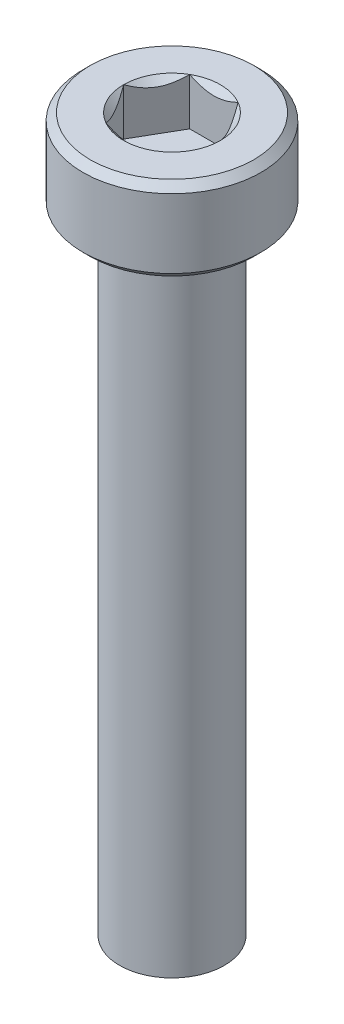
from build123d import *

# Parameters (mm, degrees)
SKETCH1_R           = 4.25
BOSS_EXTRUDE1_DEPTH = 4
CUT_EXTRUDE1_DEPTH  = 2.25
CHAMFER1_SIZE       = 0.35
SKETCH_1_R          = 2.5
EXTRUDE_1_DEPTH     = 30


with BuildPart() as part:
    # Sketch1 → Boss-Extrude1 (new body)
    with BuildSketch(Plane(origin=(0, 0, 0), x_dir=(1, 0, 0), z_dir=(0, 1, 0))):
        with Locations(Location((0, 0, 0), (0, 0, 270))):
            Circle(SKETCH1_R)
    extrude(amount=BOSS_EXTRUDE1_DEPTH)

    # Sketch2 → Cut-Extrude1 (cut)
    with BuildSketch(Plane(origin=(0, 4, 0), x_dir=(1, 0, 0), z_dir=(0, 1, 0))):
        Polygon((1.154700538, 2), (-1.154700538, 2), (-2.309401077, 0), (-1.154700538, -2), (1.154700538, -2), (2.309401077, 0), align=None)
    extrude(amount=-CUT_EXTRUDE1_DEPTH, mode=Mode.SUBTRACT)

    # Cut-Extrude2 cone 1 section (through the dimple's axis) → Cut-Extrude2 (revolve, cut)
    with BuildSketch(Plane(origin=(0, 4, 0), x_dir=(0, 0, 1), z_dir=(1, 0, 0))):
        Polygon((0, 0), (2.309401077, 0), (0, 2.309401077), align=None)
    revolve(axis=Axis((0, 4, 0), (0, -1, 0)), mode=Mode.SUBTRACT)

    # Chamfer1
    chamfer1_edges = [part.edges().sort_by_distance(p)[0] for p in [
        (0, 0, -4.25),
        (0, 4, -4.25),
    ]]
    chamfer(chamfer1_edges, length=CHAMFER1_SIZE)

    # 草图1 → 凸台-拉伸1 (add)
    with BuildSketch(Plane(origin=(0, 0, 0), x_dir=(-1, 0, 0), z_dir=(0, -1, 0))):
        with Locations(Location((0, 0, 0), (0, 0, 90))):
            Circle(SKETCH_1_R)
    extrude(amount=EXTRUDE_1_DEPTH)


solid = part.part
